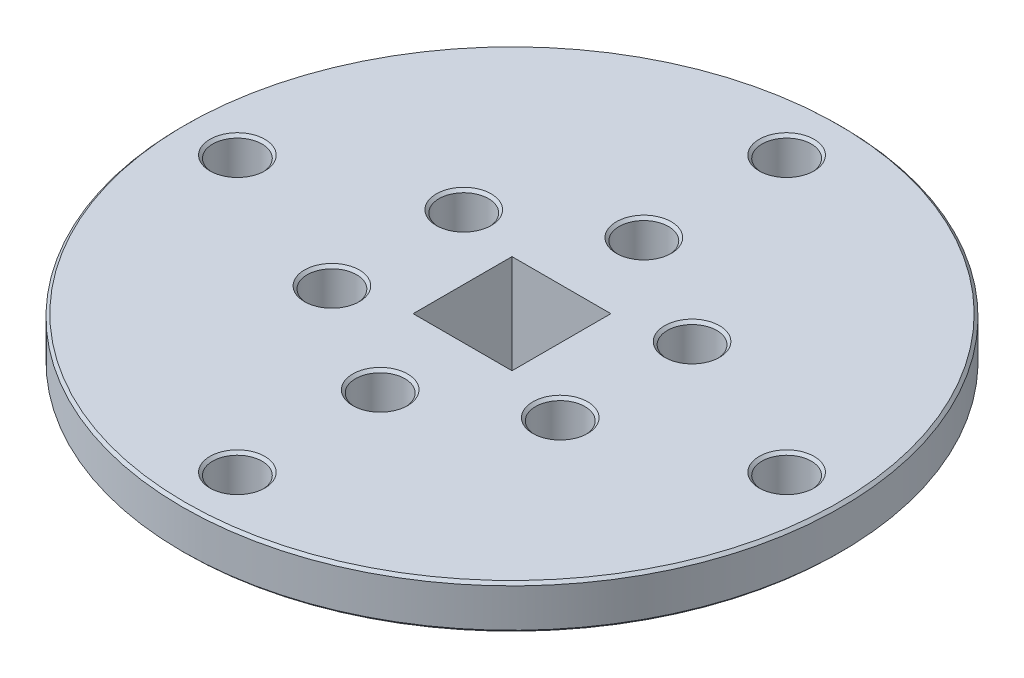
from build123d import *

# Parameters (mm, degrees)
SKIZZE1_R                       = 20.5
AUFSATZ_LINEAR_AUSTRAGEN1_DEPTH = 5
SKIZZE3_R                       = 30
AUFSATZ_LINEAR_AUSTRAGEN2_DEPTH = 4
DURCHGANGSLOCH_F_R_M41_D        = 4.5
DURCHGANGSLOCH_F_R_M42_D        = 4.5
SCHNITT_LINEAR_AUSTRAGEN1_REACH = 45.37
SKIZZE9_W                       = 9
SKIZZE9_H                       = 9
FASE1_SIZE                      = 0.25


with BuildPart() as part:
    # Skizze1 → Aufsatz-Linear austragen1 (new body)
    with BuildSketch(Plane(origin=(0, 0, 0), x_dir=(1, 0, 0), z_dir=(0, 1, 0))):
        with Locations(Location((0, 0, 0), (0, 0, 270))):
            Circle(SKIZZE1_R)
    extrude(amount=AUFSATZ_LINEAR_AUSTRAGEN1_DEPTH)

    # Skizze3 → Aufsatz-Linear austragen2 (add)
    with BuildSketch(Plane(origin=(0, 5, 0), x_dir=(1, 0, 0), z_dir=(0, 1, 0))):
        with Locations(Location((0, 0, 0), (0, 0, 270))):
            Circle(SKIZZE3_R)
    extrude(amount=AUFSATZ_LINEAR_AUSTRAGEN2_DEPTH)

    # Durchgangsloch für M41 (through all)
    with Locations(Plane(origin=(0, 5, 0), x_dir=(-1, 0, 0), z_dir=(0, -1, 0))):
        with Locations((0, 25), (-25, 0), (0, -25), (25, 0)):
            Hole(DURCHGANGSLOCH_F_R_M41_D / 2)

    # Durchgangsloch für M42 (through all)
    with Locations(Plane(origin=(0, 9, 0), x_dir=(1, 0, 0), z_dir=(0, 1, 0))):
        with Locations((-10.392304845, 6), (0, 12), (10.392304845, 6), (10.392304845, -6), (0, -12), (-10.392304845, -6)):
            Hole(DURCHGANGSLOCH_F_R_M42_D / 2)

    # Skizze9 → Schnitt-Linear austragen1 (cut, up to next)
    with BuildSketch(Plane.XZ, mode=Mode.PRIVATE) as schnitt_linear_austragen1_sk1:
        Rectangle(SKIZZE9_W, SKIZZE9_H)
    schnitt_linear_austragen1_tool1 = extrude(schnitt_linear_austragen1_sk1.sketch, amount=-SCHNITT_LINEAR_AUSTRAGEN1_REACH, mode=Mode.PRIVATE) & part.part
    add(schnitt_linear_austragen1_tool1.solids().sort_by_distance((0, 0, 0))[0], mode=Mode.SUBTRACT)

    # Fase1
    fase1_edges = [part.edges().sort_by_distance(p)[0] for p in [
        (-27.25, 5, 0),
        (-27.25, 9, 0),
        (-2.25, 5, 25),
        (-2.25, 9, 25),
        (0, 0, -20.5),
        (22.75, 5, 0),
        (22.75, 9, 0),
        (-2.25, 5, -25),
        (-2.25, 9, -25),
        (-8.142304845, 9, -6),
        (-8.142304845, 0, -6),
        (-8.142304845, 9, 6),
        (-8.142304845, 0, 6),
        (2.25, 9, 12),
        (2.25, 0, 12),
        (12.642304845, 9, 6),
        (12.642304845, 0, 6),
        (12.642304845, 9, -6),
        (12.642304845, 0, -6),
        (0, 5, -30),
        (0, 9, -30),
        (2.25, 9, -12),
        (2.25, 0, -12),
    ]]
    chamfer(fase1_edges, length=FASE1_SIZE)


solid = part.part
